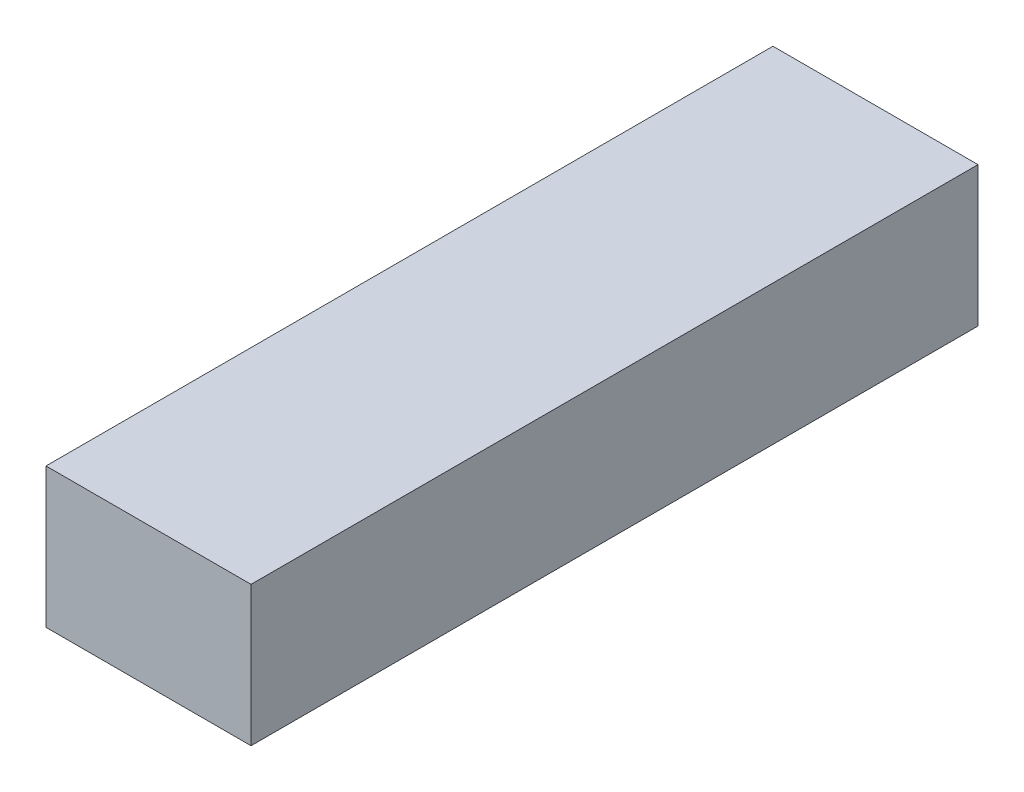
from build123d import *

# Parameters (mm, degrees)
SKETCH1_W           = 8.8
SKETCH1_H           = 31.2
SKETCH1_W_2         = 6.8
SKETCH1_H_2         = 29.2
BOSS_EXTRUDE1_DEPTH = 5
SKETCH2_W           = 8.8
SKETCH2_H           = 31.2
BOSS_EXTRUDE2_DEPTH = 1
CUT_EXTRUDE1_REACH  = 34.023
SKETCH3_W           = 29.2
SKETCH3_H           = 2


with BuildPart() as part:
    # Sketch1 → Boss-Extrude1 (new body)
    with BuildSketch(Plane(origin=(0, 0, 0), x_dir=(1, 0, 0), z_dir=(0, 1, 0))):
        with Locations((3.4, 14.6)):
            Rectangle(SKETCH1_W, SKETCH1_H)
        with Locations((3.4, 14.6)):
            Rectangle(SKETCH1_W_2, SKETCH1_H_2, mode=Mode.SUBTRACT)
    extrude(amount=BOSS_EXTRUDE1_DEPTH)

    # Sketch2 → Boss-Extrude2 (add)
    with BuildSketch(Plane(origin=(0, 5, 0), x_dir=(1, 0, 0), z_dir=(0, 1, 0))):
        with Locations((3.4, 14.6)):
            Rectangle(SKETCH2_W, SKETCH2_H)
    extrude(amount=BOSS_EXTRUDE2_DEPTH)

    # Sketch3 → Cut-Extrude1 (cut, up to next)
    with BuildSketch(Plane.ZY.offset(1), mode=Mode.PRIVATE) as cut_extrude1_sk1:
        with Locations((-14.6, 1)):
            Rectangle(SKETCH3_W, SKETCH3_H)
    cut_extrude1_tool1 = extrude(cut_extrude1_sk1.sketch, amount=-CUT_EXTRUDE1_REACH, mode=Mode.PRIVATE) & part.part
    add(cut_extrude1_tool1.solids().sort_by_distance((-1, 1, -14.6))[0], mode=Mode.SUBTRACT)


solid = part.part
